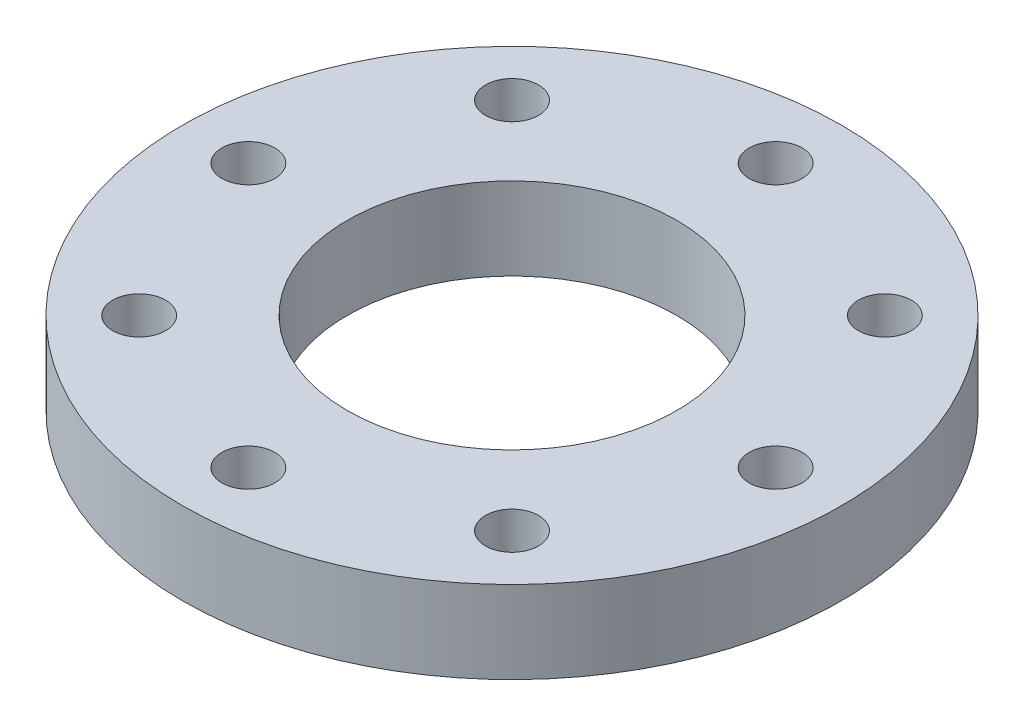
from build123d import *

# Parameters (mm, degrees)
SKETCH1_R              = 31.75
SKETCH1_R_2            = 15.875
BOSS_EXTRUDE1_DEPTH    = 7.9375
F_10_CLEARANCE_HOLE1_D = 5.1054


with BuildPart() as part:
    # Sketch1 → Boss-Extrude1 (new body)
    with BuildSketch(Plane(origin=(0, 0, 0), x_dir=(1, 0, 0), z_dir=(0, 1, 0))):
        with Locations(Location((0, 0, 0), (0, 0, 270))):
            Circle(SKETCH1_R)
        with Locations(Location((0, 0, 0), (0, 0, 270))):
            Circle(SKETCH1_R_2, mode=Mode.SUBTRACT)
    extrude(amount=BOSS_EXTRUDE1_DEPTH)

    # #10 Clearance Hole1 (through all)
    with Locations(Plane(origin=(0, 7.9375, 0), x_dir=(1, 0, 0), z_dir=(0, 1, 0))):
        with Locations((0, 25.4), (17.960512242, 17.960512242), (25.4, 0), (17.960512242, -17.960512242), (0, -25.4), (-17.960512242, -17.960512242), (-25.4, 0), (-17.960512242, 17.960512242)):
            Hole(F_10_CLEARANCE_HOLE1_D / 2)


solid = part.part
